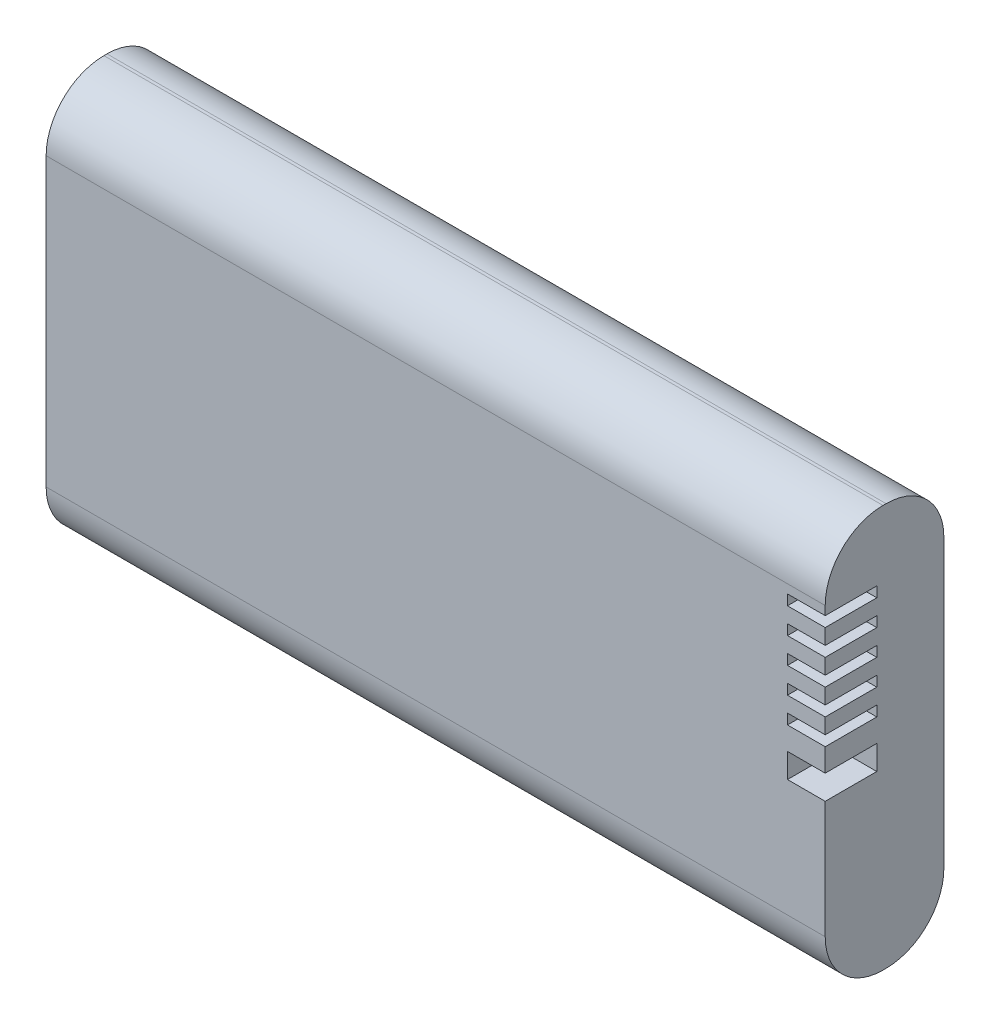
from build123d import *

# Parameters (mm, degrees)
ESQUISSE2_W             = 151
ESQUISSE2_H             = 78
BOSS_EXTRU_1_DEPTH      = 23
ESQUISSE3_W             = 10
ESQUISSE3_H             = 2
ESQUISSE3_H_2           = 4.72
ENL_V_MAT_EXTRU_1_DEPTH = 7.31
CONG_1_R                = 11.2


with BuildPart() as part:
    # Esquisse2 → Boss.-Extru.1 (new body)
    with BuildSketch(Plane.XY):
        with Locations((-24.090850635, -9.469261584)):
            Rectangle(ESQUISSE2_W, ESQUISSE2_H)
    extrude(amount=BOSS_EXTRU_1_DEPTH)

    # Esquisse3 → Enlèv. mat.-Extru.1 (cut)
    with BuildSketch(Plane(origin=(51.409149365, 0, 0), x_dir=(0, 0, -1), z_dir=(1, 0, 0))):
        with Locations((-18, 5.630738416)):
            Rectangle(ESQUISSE3_W, ESQUISSE3_H)
        with Locations((-18, 10.630738416)):
            Rectangle(ESQUISSE3_W, ESQUISSE3_H)
        with Locations((-18, -12.169261584)):
            Rectangle(ESQUISSE3_W, ESQUISSE3_H_2)
        with Locations((-18, 15.630738416)):
            Rectangle(ESQUISSE3_W, ESQUISSE3_H)
        with Locations((-18, 0.630738416)):
            Rectangle(ESQUISSE3_W, ESQUISSE3_H)
        with Locations((-18, -4.369261584)):
            Rectangle(ESQUISSE3_W, ESQUISSE3_H)
    extrude(amount=-ENL_V_MAT_EXTRU_1_DEPTH, mode=Mode.SUBTRACT)

    # Congé1
    cong_1_edges = [part.edges().sort_by_distance(p)[0] for p in [
        (-24.090850635, 29.530738416, 23),
        (-24.090850635, 29.530738416, 0),
        (-24.090850635, -48.469261584, 0),
        (-24.090850635, -48.469261584, 23),
    ]]
    fillet(cong_1_edges, radius=CONG_1_R)


solid = part.part
